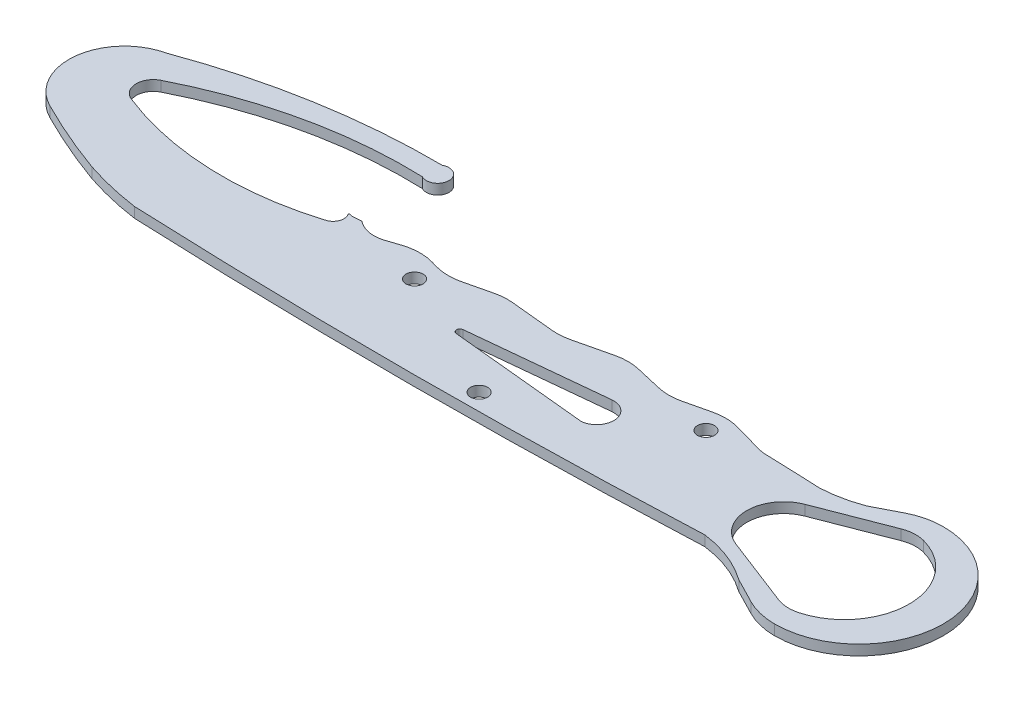
from build123d import *

# Parameters (mm, degrees)
SKETCH1_R           = 2.4999999999999987
SKETCH1_R_2         = 2.4999999999999996
SKETCH1_R_3         = 2.4999999988368367
BOSS_EXTRUDE1_DEPTH = 1.5


with BuildPart() as part:
    # Sketch1 → Boss-Extrude1 (new, symmetric)
    with BuildSketch(Plane(origin=(0, 0, 0), x_dir=(1, 0, 0), z_dir=(0, 1, 0))):
        with BuildLine():
            Line((-41.79617581077867, 2.382798182125341), (-37.73330547981784, 3.726907894077695))
            ThreePointArc((-37.73330547981784, 3.726907894077695), (-33.34023665036322, 4.48261370370704), (-28.919065231416493, 3.9139413064841877))
            Line((-28.919065231416493, 3.9139413064841877), (-27.228879505558364, 3.4332944614597887))
            ThreePointArc((-27.228879505558364, 3.4332944614597887), (-23.456808752947794, 2.864896052239951), (-19.663338722278937, 3.26636789523878))
            Line((-19.663338722278937, 3.26636789523878), (-11.919945267506879, 5.103463979240285))
            ThreePointArc((-11.919945267506879, 5.103463979240285), (-9.469729211186351, 5.474383326712289), (-6.991881476316525, 5.436826865477882))
            Line((-6.991881476316525, 5.436826865477882), (5.951872192796172, 4.166165679329836))
            ThreePointArc((5.951872192796172, 4.166165679329836), (8.429719927543827, 4.128609218087167), (10.879935983748245, 4.499528565510892))
            Line((10.879935983748245, 4.499528565510892), (21.40551753025073, 6.996690146393965))
            ThreePointArc((21.40551753025073, 6.996690146393965), (24.83264502259487, 7.401769909560215), (28.261649532088523, 7.012899060487261))
            Line((28.261649532088523, 7.012899060487261), (35.99495155066682, 5.216777544396412))
            ThreePointArc((35.99495155066682, 5.216777544396412), (39.42395606023976, 4.82790669529539), (42.85108355268613, 5.232986458392139))
            Line((42.85108355268613, 5.232986458392139), (49.96600006451842, 6.920978336659753))
            ThreePointArc((49.96600006451842, 6.920978336659753), (53.72001531855511, 7.32326878816774), (57.455567828585835, 6.77544073145873))
            Line((57.455567828585835, 6.77544073145873), (66.18925821321116, 4.3413933248153))
            ThreePointArc((66.18925821321116, 4.3413933248153), (67.36926268792493, 4.088133405140102), (68.57118312482231, 3.9788703710124524))
            ThreePointArc((68.57118312482231, 3.9788703710124524), (76.70834195009273, 3.69798054493333), (84.84283443476778, 3.3482880245078643))
            ThreePointArc((84.84283443476778, 3.3482880245078643), (90.6755684371097, 4.07235098588054), (96.32527960365518, 5.692788225862035))
            Line((96.32527960365518, 5.692788225862035), (103.59933222252589, 9.439170279671533))
            ThreePointArc((103.59933222252589, 9.439170279671533), (108.01760653283236, 11.089221722684941), (112.69942544373606, 11.658773591445987))
            ThreePointArc((112.69942544373606, 11.658773591445987), (137.42059205461962, -12.991414338135115), (112.69942544373606, -37.64160226771621))
            ThreePointArc((112.69942544373606, -37.64160226771621), (108.01760653283236, -37.07205039895516), (103.59933222252589, -35.42199895594175))
            Line((103.59933222252589, -35.42199895594175), (96.32527960365518, -31.675616902132255))
            ThreePointArc((96.32527960365518, -31.675616902132255), (88.5441551766424, -27.463864954095598), (79.9703022290949, -25.278962792836175))
            ThreePointArc((79.9703022290949, -25.278962792836175), (-3.2675277579170765, -27.22969716665807), (-86.51046185027334, -25.510502808965498))
            ThreePointArc((-86.51046185027334, -25.510502808965498), (-94.72463382860796, -23.967931939620144), (-102.76843470025015, -21.698699973958888))
            ThreePointArc((-102.76843470025015, -21.698699973958888), (-113.75910937557403, -17.35916690176714), (-124.45852861685042, -12.344298508393459))
            ThreePointArc((-124.45852861685042, -12.344298508393459), (-133.23144555995484, 4.202899533030633), (-120.59919444516926, 18.030410751095733))
            ThreePointArc((-120.59919444516926, 18.030410751095733), (-86.83004932052131, 27.105129355217315), (-51.97527685246112, 29.907006653257785))
            ThreePointArc((-51.97527685246112, 29.907006653257785), (-47.10250450667497, 27.022733824765), (-51.95035427562549, 24.096765147433302))
            ThreePointArc((-51.95035427562549, 24.096765147433302), (-84.17625346987383, 21.176955554132093), (-114.64829350025539, 10.291706667413088))
            ThreePointArc((-114.64829350025539, 10.291706667413088), (-117.36336095050851, 5.634125667179891), (-114.23380520696547, 1.244304158141715))
            ThreePointArc((-114.23380520696547, 1.244304158141715), (-84.82863856721416, -4.964735101077579), (-55.03457582625992, -1.023945964096185))
            ThreePointArc((-55.03457582625992, -1.023945964096185), (-52.956149124988286, 1.029337853892025), (-53.43468142437476, 3.9114965636467445))
            ThreePointArc((-53.43468142437476, 3.9114965636467445), (-53.00487930043318, 4.054737535668091), (-52.611913679317254, 3.829291616670397))
            ThreePointArc((-52.611913679317254, 3.829291616670397), (-51.09811473462323, 3.897658149961778), (-49.58701407449473, 4.010954322846273))
            ThreePointArc((-49.58701407449473, 4.010954322846273), (-45.88836824044927, 2.255302591622458), (-41.79617581077867, 2.382798182125341))
        make_face()
        with Locations(Location((-27.228879503846553, -2.927214905609624, 0), (0, 0, 270))):
            Circle(SKETCH1_R, mode=Mode.SUBTRACT)
        with Locations(Location((10.879935983748245, -22.16932690789429, 0), (0, 0, 270))):
            Circle(SKETCH1_R_2, mode=Mode.SUBTRACT)
        with Locations(Location((53.72001531851656, 1.3232687879424379, 0), (0, 0, 270))):
            Circle(SKETCH1_R_3, mode=Mode.SUBTRACT)
        with BuildLine():
            Line((-7.347962122783413, -8.651271752579847), (32.25203787721659, -4.6713220041533745))
            ThreePointArc((32.25203787721659, -4.6713220041533745), (37.73209037371569, -9.200078584871521), (33.1443469248767, -14.630844790428428))
            Line((33.1443469248767, -14.630844790428428), (-7.346014603537373, -10.64144043499709))
            ThreePointArc((-7.346014603537373, -10.64144043499709), (-8.24796164398419, -9.647237759156878), (-7.347962122783413, -8.651271752579847))
        make_face(mode=Mode.SUBTRACT)
        with BuildLine():
            Line((86.87503313674924, -2.91833741505861), (107.18489994547878, 4.935508738787573))
            ThreePointArc((107.18489994547878, 4.935508738787573), (110.24885192022663, 5.593844362539373), (113.36611131404287, 5.271507010179491))
            ThreePointArc((113.36611131404287, 5.271507010179491), (123.48655350207885, -1.4751872230410612), (127.40034273906164, -12.991414338135112))
            ThreePointArc((127.40034273906164, -12.991414338135112), (123.48655350207883, -24.507641453229162), (113.36611131404287, -31.25433568644971))
            ThreePointArc((113.36611131404287, -31.25433568644971), (110.24885192022663, -31.576673038809595), (107.18489994547878, -30.9183374150578))
            Line((107.18489994547878, -30.9183374150578), (86.87503313674924, -23.064491261211614))
            ThreePointArc((86.87503313674924, -23.064491261211614), (81.86219058303507, -19.097603567215177), (79.9703022290949, -12.991414338135112))
            ThreePointArc((79.9703022290949, -12.991414338135112), (81.86219058303507, -6.8852251090550425), (86.87503313674924, -2.91833741505861))
        make_face(mode=Mode.SUBTRACT)
    extrude(amount=BOSS_EXTRUDE1_DEPTH, both=True)


solid = part.part
